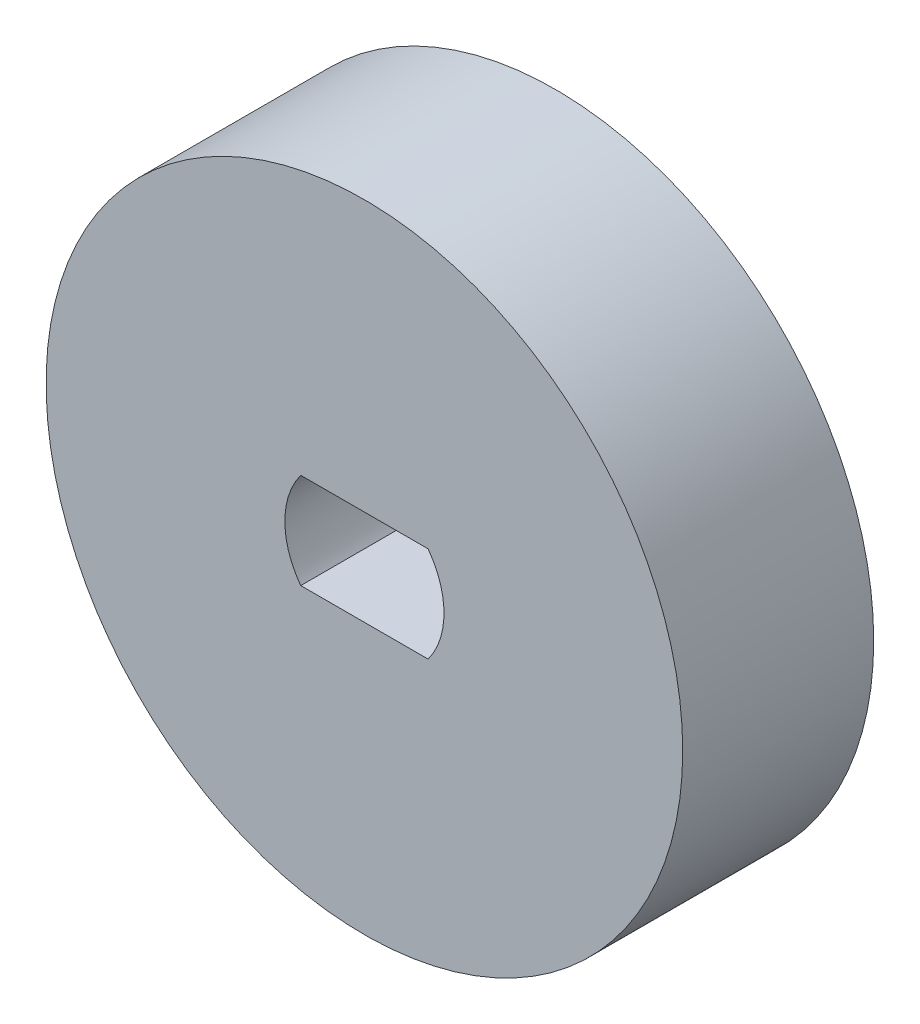
from build123d import *

# Parameters (mm, degrees)
SKETCH1_R           = 10
SKETCH1_R_2         = 2.5
BOSS_EXTRUDE1_DEPTH = 6


with BuildPart() as part:
    # Sketch1 → Boss-Extrude1 (new body)
    # profile 1 of 3: a face of its own
    with BuildSketch(Plane(origin=(0, 0, 0), x_dir=(-1, 0, 0), z_dir=(0, 0, 1))):
        with Locations(Location((-8.506234752, 0, 0), (0, 0, 180))):
            Circle(SKETCH1_R)
        with Locations((-8.506234752, 0)):
            Circle(SKETCH1_R_2, mode=Mode.SUBTRACT)
    # profile 2 of 3: a face of its own
    with BuildSketch(Plane(origin=(0, 0, 0), x_dir=(-1, 0, 0), z_dir=(0, 0, 1))):
        with BuildLine():
            Line((-6.506234752, -1.5), (-10.506234752, -1.5))
            ThreePointArc((-10.506234752, -1.5), (-8.506234752, -2.5), (-6.506234752, -1.5))
        make_face()
    # profile 3 of 3: a face of its own
    with BuildSketch(Plane(origin=(0, 0, 0), x_dir=(-1, 0, 0), z_dir=(0, 0, 1))):
        with BuildLine():
            ThreePointArc((-6.506234752, 1.5), (-8.506234752, 2.5), (-10.506234752, 1.5))
            Line((-10.506234752, 1.5), (-6.506234752, 1.5))
        make_face()
    extrude(amount=BOSS_EXTRUDE1_DEPTH)


solid = part.part
